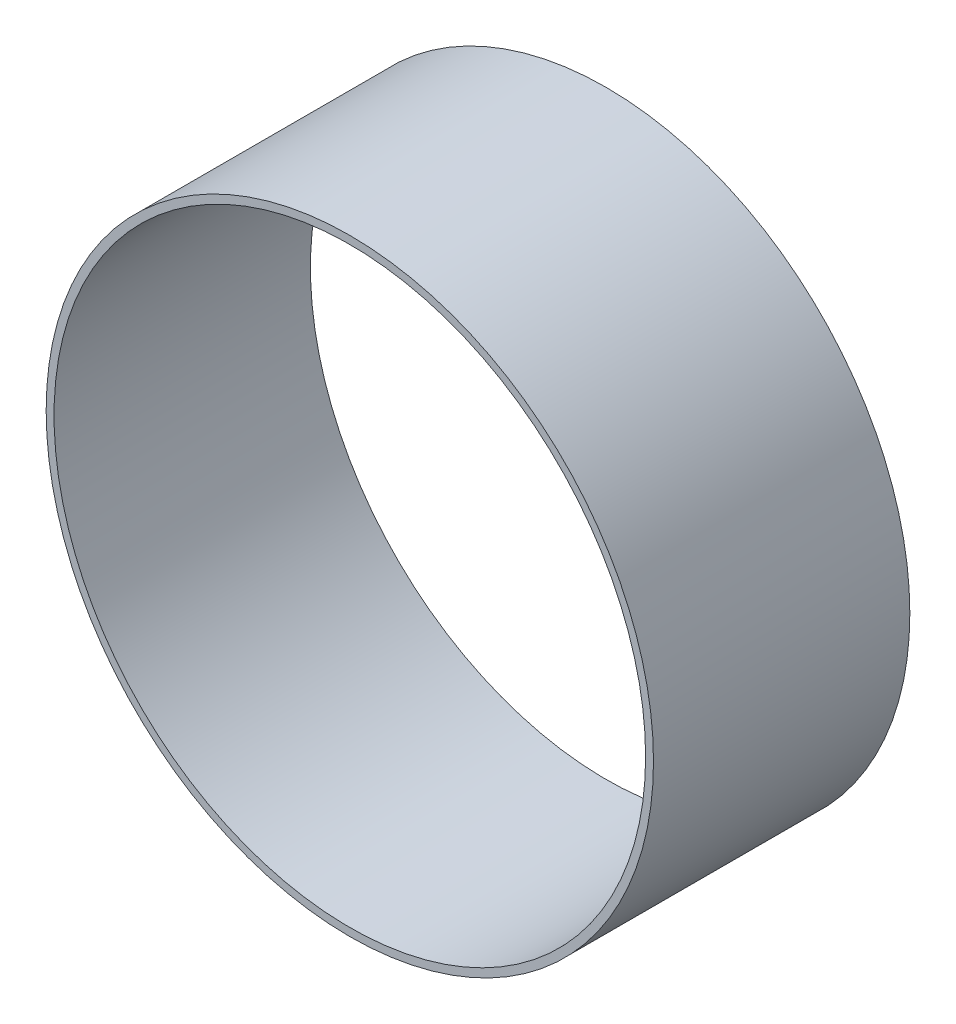
from build123d import *

# Parameters (mm, degrees)
PRINTED_FIXED_CASE_START = -32
SKETCH_1_R               = 77
SKETCH_1_R_2             = 75
PRINTED_FIXED_CASE_DEPTH = 65


with BuildPart() as part:
    # Эскиз1 → Printed_fixed_case (new body)
    with BuildSketch(Plane.XY.offset(PRINTED_FIXED_CASE_START)):
        Circle(SKETCH_1_R)
        Circle(SKETCH_1_R_2, mode=Mode.SUBTRACT)
    extrude(amount=PRINTED_FIXED_CASE_DEPTH)


solid = part.part
